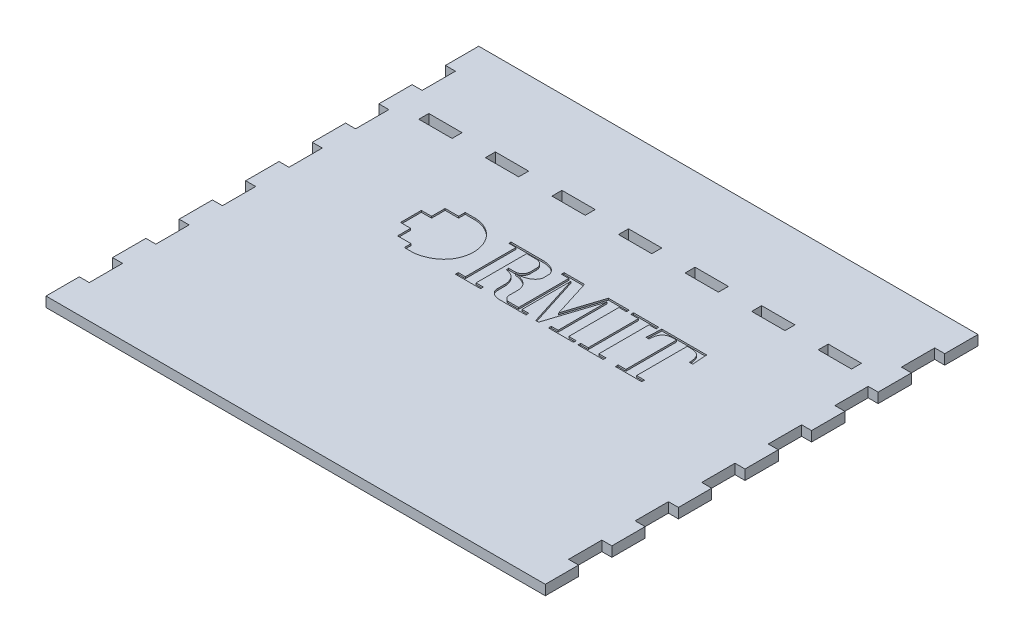
from build123d import *

# Parameters (mm, degrees)
SKETCH1_W               = 150
SKETCH1_H               = 130
BOSS_EXTRUDE1_DEPTH     = 3
SKETCH3_W               = 3
SKETCH3_H               = 10
CUT_EXTRUDE1_DEPTH      = 100.292497199
LPATTERN1_COUNT         = 6
LPATTERN1_PITCH         = 20
MIRROR1_COPY_1_SKETCH_W = 3
MIRROR1_COPY_1_SKETCH_H = 10
MIRROR1_COPY_1_DEPTH    = 100.292497199
MIRROR1_COPY_2_SKETCH_W = 3
MIRROR1_COPY_2_SKETCH_H = 10
MIRROR1_COPY_2_DEPTH    = 100.292497199
MIRROR1_COPY_3_SKETCH_W = 3
MIRROR1_COPY_3_SKETCH_H = 10
MIRROR1_COPY_3_DEPTH    = 100.292497199
MIRROR1_COPY_4_SKETCH_W = 3
MIRROR1_COPY_4_SKETCH_H = 10
MIRROR1_COPY_4_DEPTH    = 100.292497199
MIRROR1_COPY_5_SKETCH_W = 3
MIRROR1_COPY_5_SKETCH_H = 10
MIRROR1_COPY_5_DEPTH    = 100.292497199
SKETCH4_W               = 10
SKETCH4_H               = 3
CUT_EXTRUDE2_DEPTH      = 100.292497199
LPATTERN2_COUNT         = 7
LPATTERN2_PITCH         = 20
CUT_EXTRUDE3_DEPTH      = 0.5


with BuildPart() as part:
    # Sketch1 → Boss-Extrude1 (new body)
    with BuildSketch(Plane(origin=(0, 0, 0), x_dir=(1, 0, 0), z_dir=(0, 1, 0))):
        Rectangle(SKETCH1_W, SKETCH1_H)
    extrude(amount=BOSS_EXTRUDE1_DEPTH)

    # Sketch3 → Cut-Extrude1 (cut, through all)
    with BuildSketch(Plane(origin=(0, 3, 0), x_dir=(1, 0, 0), z_dir=(0, 1, 0))):
        with Locations((73.5, -50)):
            Rectangle(SKETCH3_W, SKETCH3_H)
    cut_extrude1 = extrude(amount=-CUT_EXTRUDE1_DEPTH, mode=Mode.SUBTRACT)

    # LPattern1: Cut-Extrude1 ×6
    with Locations(*[(0, 0, -i * LPATTERN1_PITCH) for i in range(1, LPATTERN1_COUNT)]):
        add(cut_extrude1, mode=Mode.SUBTRACT)

    # Mirror1: Cut-Extrude1 across plane
    add(cut_extrude1.mirror(Plane(origin=(0, 0, 0), x_dir=(0, 0, 1), z_dir=(1, 0, 0))), mode=Mode.SUBTRACT)

    # Mirror1 copy 1 sketch → Mirror1 copy 1 (cut, through all)
    with BuildSketch(Plane(origin=(0, 3, -20), x_dir=(-1, 0, 0), z_dir=(0, 1, 0))):
        with Locations((73.5, 50)):
            Rectangle(MIRROR1_COPY_1_SKETCH_W, MIRROR1_COPY_1_SKETCH_H)
    extrude(amount=-MIRROR1_COPY_1_DEPTH, mode=Mode.SUBTRACT)

    # Mirror1 copy 2 sketch → Mirror1 copy 2 (cut, through all)
    with BuildSketch(Plane(origin=(0, 3, -40), x_dir=(-1, 0, 0), z_dir=(0, 1, 0))):
        with Locations((73.5, 50)):
            Rectangle(MIRROR1_COPY_2_SKETCH_W, MIRROR1_COPY_2_SKETCH_H)
    extrude(amount=-MIRROR1_COPY_2_DEPTH, mode=Mode.SUBTRACT)

    # Mirror1 copy 3 sketch → Mirror1 copy 3 (cut, through all)
    with BuildSketch(Plane(origin=(0, 3, -60), x_dir=(-1, 0, 0), z_dir=(0, 1, 0))):
        with Locations((73.5, 50)):
            Rectangle(MIRROR1_COPY_3_SKETCH_W, MIRROR1_COPY_3_SKETCH_H)
    extrude(amount=-MIRROR1_COPY_3_DEPTH, mode=Mode.SUBTRACT)

    # Mirror1 copy 4 sketch → Mirror1 copy 4 (cut, through all)
    with BuildSketch(Plane(origin=(0, 3, -80), x_dir=(-1, 0, 0), z_dir=(0, 1, 0))):
        with Locations((73.5, 50)):
            Rectangle(MIRROR1_COPY_4_SKETCH_W, MIRROR1_COPY_4_SKETCH_H)
    extrude(amount=-MIRROR1_COPY_4_DEPTH, mode=Mode.SUBTRACT)

    # Mirror1 copy 5 sketch → Mirror1 copy 5 (cut, through all)
    with BuildSketch(Plane(origin=(0, 3, -100), x_dir=(-1, 0, 0), z_dir=(0, 1, 0))):
        with Locations((73.5, 50)):
            Rectangle(MIRROR1_COPY_5_SKETCH_W, MIRROR1_COPY_5_SKETCH_H)
    extrude(amount=-MIRROR1_COPY_5_DEPTH, mode=Mode.SUBTRACT)

    # Sketch4 → Cut-Extrude2 (cut, through all)
    with BuildSketch(Plane.XZ):
        with Locations((60, -38.5)):
            Rectangle(SKETCH4_W, SKETCH4_H)
    cut_extrude2 = extrude(amount=-CUT_EXTRUDE2_DEPTH, mode=Mode.SUBTRACT)

    # LPattern2: Cut-Extrude2 ×7
    with Locations(*[(-i * LPATTERN2_PITCH, 0, 0) for i in range(1, LPATTERN2_COUNT)]):
        add(cut_extrude2, mode=Mode.SUBTRACT)

    # Sketch7 → Cut-Extrude3 (cut)
    with BuildSketch(Plane(origin=(0, 3, 0), x_dir=(1, 0, 0), z_dir=(0, 1, 0))):
        with BuildLine():
            Line((-30.662894668, 19.72193426), (-33.781274214, 19.72193426))
            Line((-33.781274214, 19.72193426), (-33.781274214, 17.740160343))
            Line((-33.781274214, 17.740160343), (-37.83225325, 17.740160343))
            Line((-37.83225325, 17.740160343), (-37.83225325, 13.660037573))
            Line((-37.83225325, 13.660037573), (-40.892345327, 13.660037573))
            Line((-40.892345327, 13.660037573), (-40.892345327, 7.394134748))
            Line((-40.892345327, 7.394134748), (-37.83225325, 7.394134748))
            Line((-37.83225325, 7.394134748), (-37.83225325, 3.459730648))
            Line((-37.83225325, 3.459730648), (-33.781274214, 3.459730648))
            Line((-33.781274214, 3.459730648), (-33.781274214, 1.448812997))
            Line((-33.781274214, 1.448812997), (-30.662894668, 1.448812997))
            add(Edge.make_bspline(
                [(-30.662894668, 19.72193426), (-20.353298972, 19.102629925), (-18.386298534, 3.707415253), (-30.662894668, 1.448812997)],
                knots=[0, 0, 0, 0, 1, 1, 1, 1], degree=3))
        make_face()
        with BuildLine():
            Line((-9.825124807, 18.905909706), (-19.180263444, 18.905909706))
            Line((-19.180263444, 18.905909706), (-19.180263444, 18.235603822))
            Line((-19.180263444, 18.235603822), (-17.023627123, 18.235603822))
            Line((-17.023627123, 18.235603822), (-17.023627123, 3.022574637))
            Line((-17.023627123, 3.022574637), (-19.180263444, 3.022574637))
            Line((-19.180263444, 3.022574637), (-19.180263444, 2.177406349))
            Line((-19.180263444, 2.177406349), (-11.632036319, 2.177406349))
            Line((-11.632036319, 2.177406349), (-11.632036319, 3.022574637))
            Line((-11.632036319, 3.022574637), (-13.817816375, 3.022574637))
            Line((-13.817816375, 3.022574637), (-13.817816375, 11.007957773))
            Line((-13.817816375, 11.007957773), (-13.817816375, 11.736551125))
            Line((-13.817816375, 11.736551125), (-13.817816375, 18.235603822))
            Line((-13.817816375, 18.235603822), (-10.757724297, 18.235603822))
            add(Edge.make_bspline(
                [(-10.757724297, 18.235603822), (-9.277627863, 18.063454194), (-8.574989905, 17.061751955), (-8.551548098, 15.866219748)],
                knots=[0, 0, 0, 0, 1, 1, 1, 1], degree=3))
            Line((-8.551548098, 15.866219748), (-8.551548098, 13.831470778))
            add(Edge.make_bspline(
                [(-10.757724297, 11.736551125), (-9.418234341, 11.917252498), (-8.703919697, 12.729706908), (-8.551548098, 13.831470778)],
                knots=[0, 0, 0, 0, 1, 1, 1, 1], degree=3))
            Line((-10.757724297, 11.736551125), (-12.724926347, 11.736551125))
            Line((-12.724926347, 11.736551125), (-12.724926347, 11.007957773))
            add(Edge.make_bspline(
                [(-12.724926347, 11.007957773), (-10.606262718, 10.816584103), (-9.255972607, 9.456597477), (-9.117041989, 7.160653703)],
                knots=[0, 0, 0, 0, 1, 1, 1, 1], degree=3))
            Line((-9.117041989, 7.160653703), (-9.117041989, 4.836951527))
            add(Edge.make_bspline(
                [(-9.117041989, 4.836951527), (-9.155118157, 3.302548374), (-7.827695854, 2.105203885), (-5.423142908, 2.177406349)],
                knots=[0, 0, 0, 0, 1, 1, 1, 1], degree=3))
            Line((-5.423142908, 2.177406349), (2.019134318, 2.177406349))
            Line((2.019134318, 2.177406349), (2.019134318, 3.022574637))
            Line((2.019134318, 3.022574637), (0, 3.022574637))
            Line((0, 3.022574637), (0, 17.740160343))
            Line((0, 17.740160343), (4.941494485, 2.177406349))
            Line((4.941494485, 2.177406349), (5.794084725, 2.177406349))
            Line((5.794084725, 2.177406349), (10.825179622, 17.740160343))
            Line((10.825179622, 17.740160343), (10.825179622, 3.022574637))
            Line((10.825179622, 3.022574637), (8.779527505, 3.022574637))
            Line((8.779527505, 3.022574637), (8.779527505, 2.177406349))
            Line((8.779527505, 2.177406349), (16.280251935, 2.177406349))
            Line((16.280251935, 2.177406349), (16.280251935, 3.022574637))
            Line((16.280251935, 3.022574637), (14.039775806, 3.022574637))
            Line((14.039775806, 3.022574637), (14.039775806, 18.090076225))
            Line((14.039775806, 18.090076225), (16.280251935, 18.090076225))
            Line((16.280251935, 18.090076225), (16.280251935, 18.905909706))
            Line((16.280251935, 18.905909706), (10.045883578, 18.905909706))
            Line((10.045883578, 18.905909706), (6.402674569, 7.63632193))
            Line((6.402674569, 7.63632193), (2.857809187, 18.905909706))
            Line((2.857809187, 18.905909706), (-3.264366301, 18.905909706))
            Line((-3.264366301, 18.905909706), (-3.264366301, 18.090076225))
            Line((-3.264366301, 18.090076225), (-1.037708268, 18.090076225))
            Line((-1.037708268, 18.090076225), (-1.037708268, 3.022574637))
            Line((-1.037708268, 3.022574637), (-4.112144994, 3.022574637))
            add(Edge.make_bspline(
                [(-5.613614092, 4.640330573), (-5.554580923, 3.787983558), (-4.782446357, 3.039095747), (-4.112144994, 3.022574637)],
                knots=[0, 0, 0, 0, 1, 1, 1, 1], degree=3))
            Line((-5.613614092, 4.640330573), (-5.613614092, 7.160653703))
            add(Edge.make_bspline(
                [(-10.350562491, 11.396413079), (-7.0692847, 11.015131319), (-5.530010719, 9.526064164), (-5.613614092, 7.160653703)],
                knots=[0, 0, 0, 0, 1, 1, 1, 1], degree=3))
            add(Edge.make_bspline(
                [(-5.035276837, 14.384697457), (-5.230715369, 12.683782454), (-7.582346438, 11.276008247), (-10.350562491, 11.396413079)],
                knots=[0, 0, 0, 0, 1, 1, 1, 1], degree=3))
            Line((-5.035276837, 14.384697457), (-5.035276837, 15.959986982))
            add(Edge.make_bspline(
                [(-9.825124807, 18.905909706), (-6.957160276, 18.955450822), (-5.050164976, 17.648367824), (-5.035276837, 15.959986982)],
                knots=[0, 0, 0, 0, 1, 1, 1, 1], degree=3))
        make_face()
        Polygon((17.61421078, 18.905909706), (25.19929223, 18.905909706), (25.19929223, 18.090076225), (23.080700515, 18.090076225), (23.080700515, 3.022574637), (25.19929223, 3.022574637), (25.19929223, 2.177406349), (17.61421078, 2.177406349), (17.61421078, 3.022574637), (19.889735215, 3.022574637), (19.889735215, 18.090076225), (17.61421078, 18.090076225), align=None)
        with BuildLine():
            Line((25.879334015, 14.384697457), (26.114733095, 18.905909706))
            Line((26.114733095, 18.905909706), (39.584791533, 18.905909706))
            Line((39.584791533, 18.905909706), (39.872501519, 14.384697457))
            Line((39.872501519, 14.384697457), (38.904749748, 14.384697457))
            add(Edge.make_bspline(
                [(34.411836923, 18.235603822), (38.21326804, 18.453273781), (38.812368209, 16.979916615), (38.904749748, 14.384697457)],
                knots=[0, 0, 0, 0, 1, 1, 1, 1], degree=3))
            Line((34.411836923, 18.235603822), (34.411836923, 3.022574637))
            Line((34.411836923, 3.022574637), (36.786158032, 3.022574637))
            Line((36.786158032, 3.022574637), (36.786158032, 2.177406349))
            Line((36.786158032, 2.177406349), (28.887211142, 2.177406349))
            Line((28.887211142, 2.177406349), (28.887211142, 3.022574637))
            Line((28.887211142, 3.022574637), (31.188891031, 3.022574637))
            Line((31.188891031, 3.022574637), (31.188891031, 18.235603822))
            add(Edge.make_bspline(
                [(31.188891031, 18.235603822), (27.56478321, 18.515190709), (26.879827774, 16.902334535), (26.742463974, 14.384697457)],
                knots=[0, 0, 0, 0, 1, 1, 1, 1], degree=3))
            Line((26.742463974, 14.384697457), (25.879334015, 14.384697457))
        make_face()
    extrude(amount=-CUT_EXTRUDE3_DEPTH, mode=Mode.SUBTRACT)


solid = part.part
